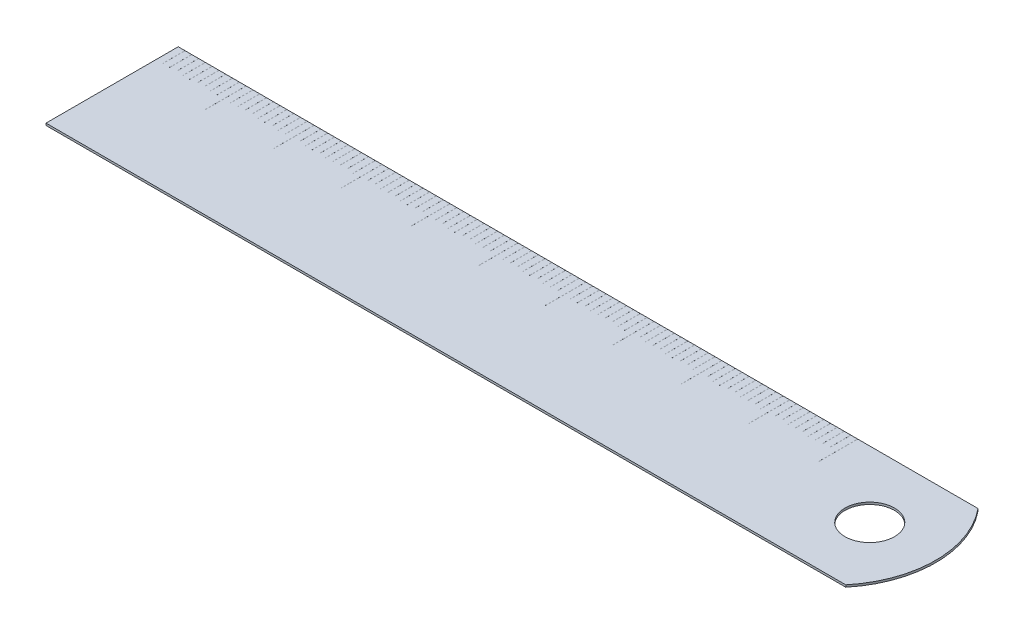
from build123d import *

# Parameters (mm, degrees)
SKETCH_1_R                        = 3.65
EXTRUDE_1_DEPTH                   = 0.31
SKETCH_2_W                        = 0.02
SKETCH_2_H                        = 12
CUT_EXTRUDE_1_DEPTH               = 0.002
PATTERN_LINEAR_1_COUNT            = 10
PATTERN_LINEAR_1_PITCH            = 10
SKETCH_3_W                        = 0.02
SKETCH_3_H                        = 6.6
CUT_EXTRUDE_3_DEPTH               = 0.002
PATTERN_LINEAR_2_COUNT            = 9
PATTERN_LINEAR_2_PITCH            = 1
PATTERN_LINEAR_3_COUNT            = 10
PATTERN_LINEAR_3_PITCH            = 10
PATTERN_LINEAR_3_COPY_1_SKETCH_W  = 0.02
PATTERN_LINEAR_3_COPY_1_SKETCH_H  = 6.6
PATTERN_LINEAR_3_COPY_1_DEPTH     = 0.002
PATTERN_LINEAR_3_COPY_2_SKETCH_W  = 0.02
PATTERN_LINEAR_3_COPY_2_SKETCH_H  = 6.6
PATTERN_LINEAR_3_COPY_2_DEPTH     = 0.002
PATTERN_LINEAR_3_COPY_3_SKETCH_W  = 0.02
PATTERN_LINEAR_3_COPY_3_SKETCH_H  = 6.6
PATTERN_LINEAR_3_COPY_3_DEPTH     = 0.002
PATTERN_LINEAR_3_COPY_4_SKETCH_W  = 0.02
PATTERN_LINEAR_3_COPY_4_SKETCH_H  = 6.6
PATTERN_LINEAR_3_COPY_4_DEPTH     = 0.002
PATTERN_LINEAR_3_COPY_5_SKETCH_W  = 0.02
PATTERN_LINEAR_3_COPY_5_SKETCH_H  = 6.6
PATTERN_LINEAR_3_COPY_5_DEPTH     = 0.002
PATTERN_LINEAR_3_COPY_6_SKETCH_W  = 0.02
PATTERN_LINEAR_3_COPY_6_SKETCH_H  = 6.6
PATTERN_LINEAR_3_COPY_6_DEPTH     = 0.002
PATTERN_LINEAR_3_COPY_7_SKETCH_W  = 0.02
PATTERN_LINEAR_3_COPY_7_SKETCH_H  = 6.6
PATTERN_LINEAR_3_COPY_7_DEPTH     = 0.002
PATTERN_LINEAR_3_COPY_8_SKETCH_W  = 0.02
PATTERN_LINEAR_3_COPY_8_SKETCH_H  = 6.6
PATTERN_LINEAR_3_COPY_8_DEPTH     = 0.002
PATTERN_LINEAR_3_COPY_9_SKETCH_W  = 0.02
PATTERN_LINEAR_3_COPY_9_SKETCH_H  = 6.6
PATTERN_LINEAR_3_COPY_9_DEPTH     = 0.002
PATTERN_LINEAR_3_COPY_10_SKETCH_W = 0.02
PATTERN_LINEAR_3_COPY_10_SKETCH_H = 6.6
PATTERN_LINEAR_3_COPY_10_DEPTH    = 0.002
PATTERN_LINEAR_3_COPY_11_SKETCH_W = 0.02
PATTERN_LINEAR_3_COPY_11_SKETCH_H = 6.6
PATTERN_LINEAR_3_COPY_11_DEPTH    = 0.002
PATTERN_LINEAR_3_COPY_12_SKETCH_W = 0.02
PATTERN_LINEAR_3_COPY_12_SKETCH_H = 6.6
PATTERN_LINEAR_3_COPY_12_DEPTH    = 0.002
PATTERN_LINEAR_3_COPY_13_SKETCH_W = 0.02
PATTERN_LINEAR_3_COPY_13_SKETCH_H = 6.6
PATTERN_LINEAR_3_COPY_13_DEPTH    = 0.002
PATTERN_LINEAR_3_COPY_14_SKETCH_W = 0.02
PATTERN_LINEAR_3_COPY_14_SKETCH_H = 6.6
PATTERN_LINEAR_3_COPY_14_DEPTH    = 0.002
PATTERN_LINEAR_3_COPY_15_SKETCH_W = 0.02
PATTERN_LINEAR_3_COPY_15_SKETCH_H = 6.6
PATTERN_LINEAR_3_COPY_15_DEPTH    = 0.002
PATTERN_LINEAR_3_COPY_16_SKETCH_W = 0.02
PATTERN_LINEAR_3_COPY_16_SKETCH_H = 6.6
PATTERN_LINEAR_3_COPY_16_DEPTH    = 0.002
PATTERN_LINEAR_3_COPY_17_SKETCH_W = 0.02
PATTERN_LINEAR_3_COPY_17_SKETCH_H = 6.6
PATTERN_LINEAR_3_COPY_17_DEPTH    = 0.002
PATTERN_LINEAR_3_COPY_18_SKETCH_W = 0.02
PATTERN_LINEAR_3_COPY_18_SKETCH_H = 6.6
PATTERN_LINEAR_3_COPY_18_DEPTH    = 0.002
PATTERN_LINEAR_3_COPY_19_SKETCH_W = 0.02
PATTERN_LINEAR_3_COPY_19_SKETCH_H = 6.6
PATTERN_LINEAR_3_COPY_19_DEPTH    = 0.002
PATTERN_LINEAR_3_COPY_20_SKETCH_W = 0.02
PATTERN_LINEAR_3_COPY_20_SKETCH_H = 6.6
PATTERN_LINEAR_3_COPY_20_DEPTH    = 0.002
PATTERN_LINEAR_3_COPY_21_SKETCH_W = 0.02
PATTERN_LINEAR_3_COPY_21_SKETCH_H = 6.6
PATTERN_LINEAR_3_COPY_21_DEPTH    = 0.002
PATTERN_LINEAR_3_COPY_22_SKETCH_W = 0.02
PATTERN_LINEAR_3_COPY_22_SKETCH_H = 6.6
PATTERN_LINEAR_3_COPY_22_DEPTH    = 0.002
PATTERN_LINEAR_3_COPY_23_SKETCH_W = 0.02
PATTERN_LINEAR_3_COPY_23_SKETCH_H = 6.6
PATTERN_LINEAR_3_COPY_23_DEPTH    = 0.002
PATTERN_LINEAR_3_COPY_24_SKETCH_W = 0.02
PATTERN_LINEAR_3_COPY_24_SKETCH_H = 6.6
PATTERN_LINEAR_3_COPY_24_DEPTH    = 0.002
PATTERN_LINEAR_3_COPY_25_SKETCH_W = 0.02
PATTERN_LINEAR_3_COPY_25_SKETCH_H = 6.6
PATTERN_LINEAR_3_COPY_25_DEPTH    = 0.002
PATTERN_LINEAR_3_COPY_26_SKETCH_W = 0.02
PATTERN_LINEAR_3_COPY_26_SKETCH_H = 6.6
PATTERN_LINEAR_3_COPY_26_DEPTH    = 0.002
PATTERN_LINEAR_3_COPY_27_SKETCH_W = 0.02
PATTERN_LINEAR_3_COPY_27_SKETCH_H = 6.6
PATTERN_LINEAR_3_COPY_27_DEPTH    = 0.002
PATTERN_LINEAR_3_COPY_28_SKETCH_W = 0.02
PATTERN_LINEAR_3_COPY_28_SKETCH_H = 6.6
PATTERN_LINEAR_3_COPY_28_DEPTH    = 0.002
PATTERN_LINEAR_3_COPY_29_SKETCH_W = 0.02
PATTERN_LINEAR_3_COPY_29_SKETCH_H = 6.6
PATTERN_LINEAR_3_COPY_29_DEPTH    = 0.002
PATTERN_LINEAR_3_COPY_30_SKETCH_W = 0.02
PATTERN_LINEAR_3_COPY_30_SKETCH_H = 6.6
PATTERN_LINEAR_3_COPY_30_DEPTH    = 0.002
PATTERN_LINEAR_3_COPY_31_SKETCH_W = 0.02
PATTERN_LINEAR_3_COPY_31_SKETCH_H = 6.6
PATTERN_LINEAR_3_COPY_31_DEPTH    = 0.002
PATTERN_LINEAR_3_COPY_32_SKETCH_W = 0.02
PATTERN_LINEAR_3_COPY_32_SKETCH_H = 6.6
PATTERN_LINEAR_3_COPY_32_DEPTH    = 0.002
PATTERN_LINEAR_3_COPY_33_SKETCH_W = 0.02
PATTERN_LINEAR_3_COPY_33_SKETCH_H = 6.6
PATTERN_LINEAR_3_COPY_33_DEPTH    = 0.002
PATTERN_LINEAR_3_COPY_34_SKETCH_W = 0.02
PATTERN_LINEAR_3_COPY_34_SKETCH_H = 6.6
PATTERN_LINEAR_3_COPY_34_DEPTH    = 0.002
PATTERN_LINEAR_3_COPY_35_SKETCH_W = 0.02
PATTERN_LINEAR_3_COPY_35_SKETCH_H = 6.6
PATTERN_LINEAR_3_COPY_35_DEPTH    = 0.002
PATTERN_LINEAR_3_COPY_36_SKETCH_W = 0.02
PATTERN_LINEAR_3_COPY_36_SKETCH_H = 6.6
PATTERN_LINEAR_3_COPY_36_DEPTH    = 0.002
PATTERN_LINEAR_3_COPY_37_SKETCH_W = 0.02
PATTERN_LINEAR_3_COPY_37_SKETCH_H = 6.6
PATTERN_LINEAR_3_COPY_37_DEPTH    = 0.002
PATTERN_LINEAR_3_COPY_38_SKETCH_W = 0.02
PATTERN_LINEAR_3_COPY_38_SKETCH_H = 6.6
PATTERN_LINEAR_3_COPY_38_DEPTH    = 0.002
PATTERN_LINEAR_3_COPY_39_SKETCH_W = 0.02
PATTERN_LINEAR_3_COPY_39_SKETCH_H = 6.6
PATTERN_LINEAR_3_COPY_39_DEPTH    = 0.002
PATTERN_LINEAR_3_COPY_40_SKETCH_W = 0.02
PATTERN_LINEAR_3_COPY_40_SKETCH_H = 6.6
PATTERN_LINEAR_3_COPY_40_DEPTH    = 0.002
PATTERN_LINEAR_3_COPY_41_SKETCH_W = 0.02
PATTERN_LINEAR_3_COPY_41_SKETCH_H = 6.6
PATTERN_LINEAR_3_COPY_41_DEPTH    = 0.002
PATTERN_LINEAR_3_COPY_42_SKETCH_W = 0.02
PATTERN_LINEAR_3_COPY_42_SKETCH_H = 6.6
PATTERN_LINEAR_3_COPY_42_DEPTH    = 0.002
PATTERN_LINEAR_3_COPY_43_SKETCH_W = 0.02
PATTERN_LINEAR_3_COPY_43_SKETCH_H = 6.6
PATTERN_LINEAR_3_COPY_43_DEPTH    = 0.002
PATTERN_LINEAR_3_COPY_44_SKETCH_W = 0.02
PATTERN_LINEAR_3_COPY_44_SKETCH_H = 6.6
PATTERN_LINEAR_3_COPY_44_DEPTH    = 0.002
PATTERN_LINEAR_3_COPY_45_SKETCH_W = 0.02
PATTERN_LINEAR_3_COPY_45_SKETCH_H = 6.6
PATTERN_LINEAR_3_COPY_45_DEPTH    = 0.002
PATTERN_LINEAR_3_COPY_46_SKETCH_W = 0.02
PATTERN_LINEAR_3_COPY_46_SKETCH_H = 6.6
PATTERN_LINEAR_3_COPY_46_DEPTH    = 0.002
PATTERN_LINEAR_3_COPY_47_SKETCH_W = 0.02
PATTERN_LINEAR_3_COPY_47_SKETCH_H = 6.6
PATTERN_LINEAR_3_COPY_47_DEPTH    = 0.002
PATTERN_LINEAR_3_COPY_48_SKETCH_W = 0.02
PATTERN_LINEAR_3_COPY_48_SKETCH_H = 6.6
PATTERN_LINEAR_3_COPY_48_DEPTH    = 0.002
PATTERN_LINEAR_3_COPY_49_SKETCH_W = 0.02
PATTERN_LINEAR_3_COPY_49_SKETCH_H = 6.6
PATTERN_LINEAR_3_COPY_49_DEPTH    = 0.002
PATTERN_LINEAR_3_COPY_50_SKETCH_W = 0.02
PATTERN_LINEAR_3_COPY_50_SKETCH_H = 6.6
PATTERN_LINEAR_3_COPY_50_DEPTH    = 0.002
PATTERN_LINEAR_3_COPY_51_SKETCH_W = 0.02
PATTERN_LINEAR_3_COPY_51_SKETCH_H = 6.6
PATTERN_LINEAR_3_COPY_51_DEPTH    = 0.002
PATTERN_LINEAR_3_COPY_52_SKETCH_W = 0.02
PATTERN_LINEAR_3_COPY_52_SKETCH_H = 6.6
PATTERN_LINEAR_3_COPY_52_DEPTH    = 0.002
PATTERN_LINEAR_3_COPY_53_SKETCH_W = 0.02
PATTERN_LINEAR_3_COPY_53_SKETCH_H = 6.6
PATTERN_LINEAR_3_COPY_53_DEPTH    = 0.002
PATTERN_LINEAR_3_COPY_54_SKETCH_W = 0.02
PATTERN_LINEAR_3_COPY_54_SKETCH_H = 6.6
PATTERN_LINEAR_3_COPY_54_DEPTH    = 0.002
PATTERN_LINEAR_3_COPY_55_SKETCH_W = 0.02
PATTERN_LINEAR_3_COPY_55_SKETCH_H = 6.6
PATTERN_LINEAR_3_COPY_55_DEPTH    = 0.002
PATTERN_LINEAR_3_COPY_56_SKETCH_W = 0.02
PATTERN_LINEAR_3_COPY_56_SKETCH_H = 6.6
PATTERN_LINEAR_3_COPY_56_DEPTH    = 0.002
PATTERN_LINEAR_3_COPY_57_SKETCH_W = 0.02
PATTERN_LINEAR_3_COPY_57_SKETCH_H = 6.6
PATTERN_LINEAR_3_COPY_57_DEPTH    = 0.002
PATTERN_LINEAR_3_COPY_58_SKETCH_W = 0.02
PATTERN_LINEAR_3_COPY_58_SKETCH_H = 6.6
PATTERN_LINEAR_3_COPY_58_DEPTH    = 0.002
PATTERN_LINEAR_3_COPY_59_SKETCH_W = 0.02
PATTERN_LINEAR_3_COPY_59_SKETCH_H = 6.6
PATTERN_LINEAR_3_COPY_59_DEPTH    = 0.002
PATTERN_LINEAR_3_COPY_60_SKETCH_W = 0.02
PATTERN_LINEAR_3_COPY_60_SKETCH_H = 6.6
PATTERN_LINEAR_3_COPY_60_DEPTH    = 0.002
PATTERN_LINEAR_3_COPY_61_SKETCH_W = 0.02
PATTERN_LINEAR_3_COPY_61_SKETCH_H = 6.6
PATTERN_LINEAR_3_COPY_61_DEPTH    = 0.002
PATTERN_LINEAR_3_COPY_62_SKETCH_W = 0.02
PATTERN_LINEAR_3_COPY_62_SKETCH_H = 6.6
PATTERN_LINEAR_3_COPY_62_DEPTH    = 0.002
PATTERN_LINEAR_3_COPY_63_SKETCH_W = 0.02
PATTERN_LINEAR_3_COPY_63_SKETCH_H = 6.6
PATTERN_LINEAR_3_COPY_63_DEPTH    = 0.002
PATTERN_LINEAR_3_COPY_64_SKETCH_W = 0.02
PATTERN_LINEAR_3_COPY_64_SKETCH_H = 6.6
PATTERN_LINEAR_3_COPY_64_DEPTH    = 0.002
PATTERN_LINEAR_3_COPY_65_SKETCH_W = 0.02
PATTERN_LINEAR_3_COPY_65_SKETCH_H = 6.6
PATTERN_LINEAR_3_COPY_65_DEPTH    = 0.002
PATTERN_LINEAR_3_COPY_66_SKETCH_W = 0.02
PATTERN_LINEAR_3_COPY_66_SKETCH_H = 6.6
PATTERN_LINEAR_3_COPY_66_DEPTH    = 0.002
PATTERN_LINEAR_3_COPY_67_SKETCH_W = 0.02
PATTERN_LINEAR_3_COPY_67_SKETCH_H = 6.6
PATTERN_LINEAR_3_COPY_67_DEPTH    = 0.002
PATTERN_LINEAR_3_COPY_68_SKETCH_W = 0.02
PATTERN_LINEAR_3_COPY_68_SKETCH_H = 6.6
PATTERN_LINEAR_3_COPY_68_DEPTH    = 0.002
PATTERN_LINEAR_3_COPY_69_SKETCH_W = 0.02
PATTERN_LINEAR_3_COPY_69_SKETCH_H = 6.6
PATTERN_LINEAR_3_COPY_69_DEPTH    = 0.002
PATTERN_LINEAR_3_COPY_70_SKETCH_W = 0.02
PATTERN_LINEAR_3_COPY_70_SKETCH_H = 6.6
PATTERN_LINEAR_3_COPY_70_DEPTH    = 0.002
PATTERN_LINEAR_3_COPY_71_SKETCH_W = 0.02
PATTERN_LINEAR_3_COPY_71_SKETCH_H = 6.6
PATTERN_LINEAR_3_COPY_71_DEPTH    = 0.002
PATTERN_LINEAR_3_COPY_72_SKETCH_W = 0.02
PATTERN_LINEAR_3_COPY_72_SKETCH_H = 6.6
PATTERN_LINEAR_3_COPY_72_DEPTH    = 0.002


with BuildPart() as part:
    # 草图1 → 凸台-拉伸1 (new body)
    with BuildSketch(Plane(origin=(0, 0, 0), x_dir=(1, 0, 0), z_dir=(0, 1, 0))):
        with BuildLine():
            Line((-60.6, -9.73), (57.1, -9.73))
            ThreePointArc((57.1, -9.73), (59.698390659, -5.170176496), (60.6, 0))
            ThreePointArc((60.6, 0), (59.698390659, 5.170176496), (57.1, 9.73))
            Line((57.1, 9.73), (-60.6, 9.73))
            Line((-60.6, 9.73), (-60.6, -9.73))
        make_face()
        with Locations(Location((50.9, 0, 0), (0, 0, 270))):
            Circle(SKETCH_1_R, mode=Mode.SUBTRACT)
    extrude(amount=EXTRUDE_1_DEPTH)

    # 草图2 → 切除-拉伸1 (cut)
    with BuildSketch(Plane(origin=(0, 0.31, 0), x_dir=(1, 0, 0), z_dir=(0, 1, 0))):
        with Locations((-50.6, 9.73)):
            Rectangle(SKETCH_2_W, SKETCH_2_H)
    cut_extrude_1 = extrude(amount=-CUT_EXTRUDE_1_DEPTH, mode=Mode.SUBTRACT)

    # 阵列(线性)1: 切除-拉伸1 ×10
    with Locations(*[(i * PATTERN_LINEAR_1_PITCH, 0, 0) for i in range(1, PATTERN_LINEAR_1_COUNT)]):
        add(cut_extrude_1, mode=Mode.SUBTRACT)

    # 草图3 → 切除-拉伸3 (cut)
    with BuildSketch(Plane(origin=(0, 0.31, 0), x_dir=(1, 0, 0), z_dir=(0, 1, 0))):
        with Locations((-59.6, 9.73)):
            Rectangle(SKETCH_3_W, SKETCH_3_H)
    cut_extrude_3 = extrude(amount=-CUT_EXTRUDE_3_DEPTH, mode=Mode.SUBTRACT)

    # 阵列(线性)2: 切除-拉伸3 ×9
    with Locations(*[(i * PATTERN_LINEAR_2_PITCH, 0, 0) for i in range(1, PATTERN_LINEAR_2_COUNT)]):
        add(cut_extrude_3, mode=Mode.SUBTRACT)

    # 阵列(线性)3: 切除-拉伸3 ×10
    with Locations(*[(i * PATTERN_LINEAR_3_PITCH, 0, 0) for i in range(1, PATTERN_LINEAR_3_COUNT)]):
        add(cut_extrude_3, mode=Mode.SUBTRACT)

    # 阵列(线性)3 copy 1 sketch → 阵列(线性)3 copy 1 (cut)
    with BuildSketch(Plane(origin=(11, 0.31, 0), x_dir=(1, 0, 0), z_dir=(0, 1, 0))):
        with Locations((-59.6, 9.73)):
            Rectangle(PATTERN_LINEAR_3_COPY_1_SKETCH_W, PATTERN_LINEAR_3_COPY_1_SKETCH_H)
    extrude(amount=-PATTERN_LINEAR_3_COPY_1_DEPTH, mode=Mode.SUBTRACT)

    # 阵列(线性)3 copy 2 sketch → 阵列(线性)3 copy 2 (cut)
    with BuildSketch(Plane(origin=(21, 0.31, 0), x_dir=(1, 0, 0), z_dir=(0, 1, 0))):
        with Locations((-59.6, 9.73)):
            Rectangle(PATTERN_LINEAR_3_COPY_2_SKETCH_W, PATTERN_LINEAR_3_COPY_2_SKETCH_H)
    extrude(amount=-PATTERN_LINEAR_3_COPY_2_DEPTH, mode=Mode.SUBTRACT)

    # 阵列(线性)3 copy 3 sketch → 阵列(线性)3 copy 3 (cut)
    with BuildSketch(Plane(origin=(31, 0.31, 0), x_dir=(1, 0, 0), z_dir=(0, 1, 0))):
        with Locations((-59.6, 9.73)):
            Rectangle(PATTERN_LINEAR_3_COPY_3_SKETCH_W, PATTERN_LINEAR_3_COPY_3_SKETCH_H)
    extrude(amount=-PATTERN_LINEAR_3_COPY_3_DEPTH, mode=Mode.SUBTRACT)

    # 阵列(线性)3 copy 4 sketch → 阵列(线性)3 copy 4 (cut)
    with BuildSketch(Plane(origin=(41, 0.31, 0), x_dir=(1, 0, 0), z_dir=(0, 1, 0))):
        with Locations((-59.6, 9.73)):
            Rectangle(PATTERN_LINEAR_3_COPY_4_SKETCH_W, PATTERN_LINEAR_3_COPY_4_SKETCH_H)
    extrude(amount=-PATTERN_LINEAR_3_COPY_4_DEPTH, mode=Mode.SUBTRACT)

    # 阵列(线性)3 copy 5 sketch → 阵列(线性)3 copy 5 (cut)
    with BuildSketch(Plane(origin=(51, 0.31, 0), x_dir=(1, 0, 0), z_dir=(0, 1, 0))):
        with Locations((-59.6, 9.73)):
            Rectangle(PATTERN_LINEAR_3_COPY_5_SKETCH_W, PATTERN_LINEAR_3_COPY_5_SKETCH_H)
    extrude(amount=-PATTERN_LINEAR_3_COPY_5_DEPTH, mode=Mode.SUBTRACT)

    # 阵列(线性)3 copy 6 sketch → 阵列(线性)3 copy 6 (cut)
    with BuildSketch(Plane(origin=(61, 0.31, 0), x_dir=(1, 0, 0), z_dir=(0, 1, 0))):
        with Locations((-59.6, 9.73)):
            Rectangle(PATTERN_LINEAR_3_COPY_6_SKETCH_W, PATTERN_LINEAR_3_COPY_6_SKETCH_H)
    extrude(amount=-PATTERN_LINEAR_3_COPY_6_DEPTH, mode=Mode.SUBTRACT)

    # 阵列(线性)3 copy 7 sketch → 阵列(线性)3 copy 7 (cut)
    with BuildSketch(Plane(origin=(71, 0.31, 0), x_dir=(1, 0, 0), z_dir=(0, 1, 0))):
        with Locations((-59.6, 9.73)):
            Rectangle(PATTERN_LINEAR_3_COPY_7_SKETCH_W, PATTERN_LINEAR_3_COPY_7_SKETCH_H)
    extrude(amount=-PATTERN_LINEAR_3_COPY_7_DEPTH, mode=Mode.SUBTRACT)

    # 阵列(线性)3 copy 8 sketch → 阵列(线性)3 copy 8 (cut)
    with BuildSketch(Plane(origin=(81, 0.31, 0), x_dir=(1, 0, 0), z_dir=(0, 1, 0))):
        with Locations((-59.6, 9.73)):
            Rectangle(PATTERN_LINEAR_3_COPY_8_SKETCH_W, PATTERN_LINEAR_3_COPY_8_SKETCH_H)
    extrude(amount=-PATTERN_LINEAR_3_COPY_8_DEPTH, mode=Mode.SUBTRACT)

    # 阵列(线性)3 copy 9 sketch → 阵列(线性)3 copy 9 (cut)
    with BuildSketch(Plane(origin=(91, 0.31, 0), x_dir=(1, 0, 0), z_dir=(0, 1, 0))):
        with Locations((-59.6, 9.73)):
            Rectangle(PATTERN_LINEAR_3_COPY_9_SKETCH_W, PATTERN_LINEAR_3_COPY_9_SKETCH_H)
    extrude(amount=-PATTERN_LINEAR_3_COPY_9_DEPTH, mode=Mode.SUBTRACT)

    # 阵列(线性)3 copy 10 sketch → 阵列(线性)3 copy 10 (cut)
    with BuildSketch(Plane(origin=(12, 0.31, 0), x_dir=(1, 0, 0), z_dir=(0, 1, 0))):
        with Locations((-59.6, 9.73)):
            Rectangle(PATTERN_LINEAR_3_COPY_10_SKETCH_W, PATTERN_LINEAR_3_COPY_10_SKETCH_H)
    extrude(amount=-PATTERN_LINEAR_3_COPY_10_DEPTH, mode=Mode.SUBTRACT)

    # 阵列(线性)3 copy 11 sketch → 阵列(线性)3 copy 11 (cut)
    with BuildSketch(Plane(origin=(22, 0.31, 0), x_dir=(1, 0, 0), z_dir=(0, 1, 0))):
        with Locations((-59.6, 9.73)):
            Rectangle(PATTERN_LINEAR_3_COPY_11_SKETCH_W, PATTERN_LINEAR_3_COPY_11_SKETCH_H)
    extrude(amount=-PATTERN_LINEAR_3_COPY_11_DEPTH, mode=Mode.SUBTRACT)

    # 阵列(线性)3 copy 12 sketch → 阵列(线性)3 copy 12 (cut)
    with BuildSketch(Plane(origin=(32, 0.31, 0), x_dir=(1, 0, 0), z_dir=(0, 1, 0))):
        with Locations((-59.6, 9.73)):
            Rectangle(PATTERN_LINEAR_3_COPY_12_SKETCH_W, PATTERN_LINEAR_3_COPY_12_SKETCH_H)
    extrude(amount=-PATTERN_LINEAR_3_COPY_12_DEPTH, mode=Mode.SUBTRACT)

    # 阵列(线性)3 copy 13 sketch → 阵列(线性)3 copy 13 (cut)
    with BuildSketch(Plane(origin=(42, 0.31, 0), x_dir=(1, 0, 0), z_dir=(0, 1, 0))):
        with Locations((-59.6, 9.73)):
            Rectangle(PATTERN_LINEAR_3_COPY_13_SKETCH_W, PATTERN_LINEAR_3_COPY_13_SKETCH_H)
    extrude(amount=-PATTERN_LINEAR_3_COPY_13_DEPTH, mode=Mode.SUBTRACT)

    # 阵列(线性)3 copy 14 sketch → 阵列(线性)3 copy 14 (cut)
    with BuildSketch(Plane(origin=(52, 0.31, 0), x_dir=(1, 0, 0), z_dir=(0, 1, 0))):
        with Locations((-59.6, 9.73)):
            Rectangle(PATTERN_LINEAR_3_COPY_14_SKETCH_W, PATTERN_LINEAR_3_COPY_14_SKETCH_H)
    extrude(amount=-PATTERN_LINEAR_3_COPY_14_DEPTH, mode=Mode.SUBTRACT)

    # 阵列(线性)3 copy 15 sketch → 阵列(线性)3 copy 15 (cut)
    with BuildSketch(Plane(origin=(62, 0.31, 0), x_dir=(1, 0, 0), z_dir=(0, 1, 0))):
        with Locations((-59.6, 9.73)):
            Rectangle(PATTERN_LINEAR_3_COPY_15_SKETCH_W, PATTERN_LINEAR_3_COPY_15_SKETCH_H)
    extrude(amount=-PATTERN_LINEAR_3_COPY_15_DEPTH, mode=Mode.SUBTRACT)

    # 阵列(线性)3 copy 16 sketch → 阵列(线性)3 copy 16 (cut)
    with BuildSketch(Plane(origin=(72, 0.31, 0), x_dir=(1, 0, 0), z_dir=(0, 1, 0))):
        with Locations((-59.6, 9.73)):
            Rectangle(PATTERN_LINEAR_3_COPY_16_SKETCH_W, PATTERN_LINEAR_3_COPY_16_SKETCH_H)
    extrude(amount=-PATTERN_LINEAR_3_COPY_16_DEPTH, mode=Mode.SUBTRACT)

    # 阵列(线性)3 copy 17 sketch → 阵列(线性)3 copy 17 (cut)
    with BuildSketch(Plane(origin=(82, 0.31, 0), x_dir=(1, 0, 0), z_dir=(0, 1, 0))):
        with Locations((-59.6, 9.73)):
            Rectangle(PATTERN_LINEAR_3_COPY_17_SKETCH_W, PATTERN_LINEAR_3_COPY_17_SKETCH_H)
    extrude(amount=-PATTERN_LINEAR_3_COPY_17_DEPTH, mode=Mode.SUBTRACT)

    # 阵列(线性)3 copy 18 sketch → 阵列(线性)3 copy 18 (cut)
    with BuildSketch(Plane(origin=(92, 0.31, 0), x_dir=(1, 0, 0), z_dir=(0, 1, 0))):
        with Locations((-59.6, 9.73)):
            Rectangle(PATTERN_LINEAR_3_COPY_18_SKETCH_W, PATTERN_LINEAR_3_COPY_18_SKETCH_H)
    extrude(amount=-PATTERN_LINEAR_3_COPY_18_DEPTH, mode=Mode.SUBTRACT)

    # 阵列(线性)3 copy 19 sketch → 阵列(线性)3 copy 19 (cut)
    with BuildSketch(Plane(origin=(13, 0.31, 0), x_dir=(1, 0, 0), z_dir=(0, 1, 0))):
        with Locations((-59.6, 9.73)):
            Rectangle(PATTERN_LINEAR_3_COPY_19_SKETCH_W, PATTERN_LINEAR_3_COPY_19_SKETCH_H)
    extrude(amount=-PATTERN_LINEAR_3_COPY_19_DEPTH, mode=Mode.SUBTRACT)

    # 阵列(线性)3 copy 20 sketch → 阵列(线性)3 copy 20 (cut)
    with BuildSketch(Plane(origin=(23, 0.31, 0), x_dir=(1, 0, 0), z_dir=(0, 1, 0))):
        with Locations((-59.6, 9.73)):
            Rectangle(PATTERN_LINEAR_3_COPY_20_SKETCH_W, PATTERN_LINEAR_3_COPY_20_SKETCH_H)
    extrude(amount=-PATTERN_LINEAR_3_COPY_20_DEPTH, mode=Mode.SUBTRACT)

    # 阵列(线性)3 copy 21 sketch → 阵列(线性)3 copy 21 (cut)
    with BuildSketch(Plane(origin=(33, 0.31, 0), x_dir=(1, 0, 0), z_dir=(0, 1, 0))):
        with Locations((-59.6, 9.73)):
            Rectangle(PATTERN_LINEAR_3_COPY_21_SKETCH_W, PATTERN_LINEAR_3_COPY_21_SKETCH_H)
    extrude(amount=-PATTERN_LINEAR_3_COPY_21_DEPTH, mode=Mode.SUBTRACT)

    # 阵列(线性)3 copy 22 sketch → 阵列(线性)3 copy 22 (cut)
    with BuildSketch(Plane(origin=(43, 0.31, 0), x_dir=(1, 0, 0), z_dir=(0, 1, 0))):
        with Locations((-59.6, 9.73)):
            Rectangle(PATTERN_LINEAR_3_COPY_22_SKETCH_W, PATTERN_LINEAR_3_COPY_22_SKETCH_H)
    extrude(amount=-PATTERN_LINEAR_3_COPY_22_DEPTH, mode=Mode.SUBTRACT)

    # 阵列(线性)3 copy 23 sketch → 阵列(线性)3 copy 23 (cut)
    with BuildSketch(Plane(origin=(53, 0.31, 0), x_dir=(1, 0, 0), z_dir=(0, 1, 0))):
        with Locations((-59.6, 9.73)):
            Rectangle(PATTERN_LINEAR_3_COPY_23_SKETCH_W, PATTERN_LINEAR_3_COPY_23_SKETCH_H)
    extrude(amount=-PATTERN_LINEAR_3_COPY_23_DEPTH, mode=Mode.SUBTRACT)

    # 阵列(线性)3 copy 24 sketch → 阵列(线性)3 copy 24 (cut)
    with BuildSketch(Plane(origin=(63, 0.31, 0), x_dir=(1, 0, 0), z_dir=(0, 1, 0))):
        with Locations((-59.6, 9.73)):
            Rectangle(PATTERN_LINEAR_3_COPY_24_SKETCH_W, PATTERN_LINEAR_3_COPY_24_SKETCH_H)
    extrude(amount=-PATTERN_LINEAR_3_COPY_24_DEPTH, mode=Mode.SUBTRACT)

    # 阵列(线性)3 copy 25 sketch → 阵列(线性)3 copy 25 (cut)
    with BuildSketch(Plane(origin=(73, 0.31, 0), x_dir=(1, 0, 0), z_dir=(0, 1, 0))):
        with Locations((-59.6, 9.73)):
            Rectangle(PATTERN_LINEAR_3_COPY_25_SKETCH_W, PATTERN_LINEAR_3_COPY_25_SKETCH_H)
    extrude(amount=-PATTERN_LINEAR_3_COPY_25_DEPTH, mode=Mode.SUBTRACT)

    # 阵列(线性)3 copy 26 sketch → 阵列(线性)3 copy 26 (cut)
    with BuildSketch(Plane(origin=(83, 0.31, 0), x_dir=(1, 0, 0), z_dir=(0, 1, 0))):
        with Locations((-59.6, 9.73)):
            Rectangle(PATTERN_LINEAR_3_COPY_26_SKETCH_W, PATTERN_LINEAR_3_COPY_26_SKETCH_H)
    extrude(amount=-PATTERN_LINEAR_3_COPY_26_DEPTH, mode=Mode.SUBTRACT)

    # 阵列(线性)3 copy 27 sketch → 阵列(线性)3 copy 27 (cut)
    with BuildSketch(Plane(origin=(93, 0.31, 0), x_dir=(1, 0, 0), z_dir=(0, 1, 0))):
        with Locations((-59.6, 9.73)):
            Rectangle(PATTERN_LINEAR_3_COPY_27_SKETCH_W, PATTERN_LINEAR_3_COPY_27_SKETCH_H)
    extrude(amount=-PATTERN_LINEAR_3_COPY_27_DEPTH, mode=Mode.SUBTRACT)

    # 阵列(线性)3 copy 28 sketch → 阵列(线性)3 copy 28 (cut)
    with BuildSketch(Plane(origin=(14, 0.31, 0), x_dir=(1, 0, 0), z_dir=(0, 1, 0))):
        with Locations((-59.6, 9.73)):
            Rectangle(PATTERN_LINEAR_3_COPY_28_SKETCH_W, PATTERN_LINEAR_3_COPY_28_SKETCH_H)
    extrude(amount=-PATTERN_LINEAR_3_COPY_28_DEPTH, mode=Mode.SUBTRACT)

    # 阵列(线性)3 copy 29 sketch → 阵列(线性)3 copy 29 (cut)
    with BuildSketch(Plane(origin=(24, 0.31, 0), x_dir=(1, 0, 0), z_dir=(0, 1, 0))):
        with Locations((-59.6, 9.73)):
            Rectangle(PATTERN_LINEAR_3_COPY_29_SKETCH_W, PATTERN_LINEAR_3_COPY_29_SKETCH_H)
    extrude(amount=-PATTERN_LINEAR_3_COPY_29_DEPTH, mode=Mode.SUBTRACT)

    # 阵列(线性)3 copy 30 sketch → 阵列(线性)3 copy 30 (cut)
    with BuildSketch(Plane(origin=(34, 0.31, 0), x_dir=(1, 0, 0), z_dir=(0, 1, 0))):
        with Locations((-59.6, 9.73)):
            Rectangle(PATTERN_LINEAR_3_COPY_30_SKETCH_W, PATTERN_LINEAR_3_COPY_30_SKETCH_H)
    extrude(amount=-PATTERN_LINEAR_3_COPY_30_DEPTH, mode=Mode.SUBTRACT)

    # 阵列(线性)3 copy 31 sketch → 阵列(线性)3 copy 31 (cut)
    with BuildSketch(Plane(origin=(44, 0.31, 0), x_dir=(1, 0, 0), z_dir=(0, 1, 0))):
        with Locations((-59.6, 9.73)):
            Rectangle(PATTERN_LINEAR_3_COPY_31_SKETCH_W, PATTERN_LINEAR_3_COPY_31_SKETCH_H)
    extrude(amount=-PATTERN_LINEAR_3_COPY_31_DEPTH, mode=Mode.SUBTRACT)

    # 阵列(线性)3 copy 32 sketch → 阵列(线性)3 copy 32 (cut)
    with BuildSketch(Plane(origin=(54, 0.31, 0), x_dir=(1, 0, 0), z_dir=(0, 1, 0))):
        with Locations((-59.6, 9.73)):
            Rectangle(PATTERN_LINEAR_3_COPY_32_SKETCH_W, PATTERN_LINEAR_3_COPY_32_SKETCH_H)
    extrude(amount=-PATTERN_LINEAR_3_COPY_32_DEPTH, mode=Mode.SUBTRACT)

    # 阵列(线性)3 copy 33 sketch → 阵列(线性)3 copy 33 (cut)
    with BuildSketch(Plane(origin=(64, 0.31, 0), x_dir=(1, 0, 0), z_dir=(0, 1, 0))):
        with Locations((-59.6, 9.73)):
            Rectangle(PATTERN_LINEAR_3_COPY_33_SKETCH_W, PATTERN_LINEAR_3_COPY_33_SKETCH_H)
    extrude(amount=-PATTERN_LINEAR_3_COPY_33_DEPTH, mode=Mode.SUBTRACT)

    # 阵列(线性)3 copy 34 sketch → 阵列(线性)3 copy 34 (cut)
    with BuildSketch(Plane(origin=(74, 0.31, 0), x_dir=(1, 0, 0), z_dir=(0, 1, 0))):
        with Locations((-59.6, 9.73)):
            Rectangle(PATTERN_LINEAR_3_COPY_34_SKETCH_W, PATTERN_LINEAR_3_COPY_34_SKETCH_H)
    extrude(amount=-PATTERN_LINEAR_3_COPY_34_DEPTH, mode=Mode.SUBTRACT)

    # 阵列(线性)3 copy 35 sketch → 阵列(线性)3 copy 35 (cut)
    with BuildSketch(Plane(origin=(84, 0.31, 0), x_dir=(1, 0, 0), z_dir=(0, 1, 0))):
        with Locations((-59.6, 9.73)):
            Rectangle(PATTERN_LINEAR_3_COPY_35_SKETCH_W, PATTERN_LINEAR_3_COPY_35_SKETCH_H)
    extrude(amount=-PATTERN_LINEAR_3_COPY_35_DEPTH, mode=Mode.SUBTRACT)

    # 阵列(线性)3 copy 36 sketch → 阵列(线性)3 copy 36 (cut)
    with BuildSketch(Plane(origin=(94, 0.31, 0), x_dir=(1, 0, 0), z_dir=(0, 1, 0))):
        with Locations((-59.6, 9.73)):
            Rectangle(PATTERN_LINEAR_3_COPY_36_SKETCH_W, PATTERN_LINEAR_3_COPY_36_SKETCH_H)
    extrude(amount=-PATTERN_LINEAR_3_COPY_36_DEPTH, mode=Mode.SUBTRACT)

    # 阵列(线性)3 copy 37 sketch → 阵列(线性)3 copy 37 (cut)
    with BuildSketch(Plane(origin=(15, 0.31, 0), x_dir=(1, 0, 0), z_dir=(0, 1, 0))):
        with Locations((-59.6, 9.73)):
            Rectangle(PATTERN_LINEAR_3_COPY_37_SKETCH_W, PATTERN_LINEAR_3_COPY_37_SKETCH_H)
    extrude(amount=-PATTERN_LINEAR_3_COPY_37_DEPTH, mode=Mode.SUBTRACT)

    # 阵列(线性)3 copy 38 sketch → 阵列(线性)3 copy 38 (cut)
    with BuildSketch(Plane(origin=(25, 0.31, 0), x_dir=(1, 0, 0), z_dir=(0, 1, 0))):
        with Locations((-59.6, 9.73)):
            Rectangle(PATTERN_LINEAR_3_COPY_38_SKETCH_W, PATTERN_LINEAR_3_COPY_38_SKETCH_H)
    extrude(amount=-PATTERN_LINEAR_3_COPY_38_DEPTH, mode=Mode.SUBTRACT)

    # 阵列(线性)3 copy 39 sketch → 阵列(线性)3 copy 39 (cut)
    with BuildSketch(Plane(origin=(35, 0.31, 0), x_dir=(1, 0, 0), z_dir=(0, 1, 0))):
        with Locations((-59.6, 9.73)):
            Rectangle(PATTERN_LINEAR_3_COPY_39_SKETCH_W, PATTERN_LINEAR_3_COPY_39_SKETCH_H)
    extrude(amount=-PATTERN_LINEAR_3_COPY_39_DEPTH, mode=Mode.SUBTRACT)

    # 阵列(线性)3 copy 40 sketch → 阵列(线性)3 copy 40 (cut)
    with BuildSketch(Plane(origin=(45, 0.31, 0), x_dir=(1, 0, 0), z_dir=(0, 1, 0))):
        with Locations((-59.6, 9.73)):
            Rectangle(PATTERN_LINEAR_3_COPY_40_SKETCH_W, PATTERN_LINEAR_3_COPY_40_SKETCH_H)
    extrude(amount=-PATTERN_LINEAR_3_COPY_40_DEPTH, mode=Mode.SUBTRACT)

    # 阵列(线性)3 copy 41 sketch → 阵列(线性)3 copy 41 (cut)
    with BuildSketch(Plane(origin=(55, 0.31, 0), x_dir=(1, 0, 0), z_dir=(0, 1, 0))):
        with Locations((-59.6, 9.73)):
            Rectangle(PATTERN_LINEAR_3_COPY_41_SKETCH_W, PATTERN_LINEAR_3_COPY_41_SKETCH_H)
    extrude(amount=-PATTERN_LINEAR_3_COPY_41_DEPTH, mode=Mode.SUBTRACT)

    # 阵列(线性)3 copy 42 sketch → 阵列(线性)3 copy 42 (cut)
    with BuildSketch(Plane(origin=(65, 0.31, 0), x_dir=(1, 0, 0), z_dir=(0, 1, 0))):
        with Locations((-59.6, 9.73)):
            Rectangle(PATTERN_LINEAR_3_COPY_42_SKETCH_W, PATTERN_LINEAR_3_COPY_42_SKETCH_H)
    extrude(amount=-PATTERN_LINEAR_3_COPY_42_DEPTH, mode=Mode.SUBTRACT)

    # 阵列(线性)3 copy 43 sketch → 阵列(线性)3 copy 43 (cut)
    with BuildSketch(Plane(origin=(75, 0.31, 0), x_dir=(1, 0, 0), z_dir=(0, 1, 0))):
        with Locations((-59.6, 9.73)):
            Rectangle(PATTERN_LINEAR_3_COPY_43_SKETCH_W, PATTERN_LINEAR_3_COPY_43_SKETCH_H)
    extrude(amount=-PATTERN_LINEAR_3_COPY_43_DEPTH, mode=Mode.SUBTRACT)

    # 阵列(线性)3 copy 44 sketch → 阵列(线性)3 copy 44 (cut)
    with BuildSketch(Plane(origin=(85, 0.31, 0), x_dir=(1, 0, 0), z_dir=(0, 1, 0))):
        with Locations((-59.6, 9.73)):
            Rectangle(PATTERN_LINEAR_3_COPY_44_SKETCH_W, PATTERN_LINEAR_3_COPY_44_SKETCH_H)
    extrude(amount=-PATTERN_LINEAR_3_COPY_44_DEPTH, mode=Mode.SUBTRACT)

    # 阵列(线性)3 copy 45 sketch → 阵列(线性)3 copy 45 (cut)
    with BuildSketch(Plane(origin=(95, 0.31, 0), x_dir=(1, 0, 0), z_dir=(0, 1, 0))):
        with Locations((-59.6, 9.73)):
            Rectangle(PATTERN_LINEAR_3_COPY_45_SKETCH_W, PATTERN_LINEAR_3_COPY_45_SKETCH_H)
    extrude(amount=-PATTERN_LINEAR_3_COPY_45_DEPTH, mode=Mode.SUBTRACT)

    # 阵列(线性)3 copy 46 sketch → 阵列(线性)3 copy 46 (cut)
    with BuildSketch(Plane(origin=(16, 0.31, 0), x_dir=(1, 0, 0), z_dir=(0, 1, 0))):
        with Locations((-59.6, 9.73)):
            Rectangle(PATTERN_LINEAR_3_COPY_46_SKETCH_W, PATTERN_LINEAR_3_COPY_46_SKETCH_H)
    extrude(amount=-PATTERN_LINEAR_3_COPY_46_DEPTH, mode=Mode.SUBTRACT)

    # 阵列(线性)3 copy 47 sketch → 阵列(线性)3 copy 47 (cut)
    with BuildSketch(Plane(origin=(26, 0.31, 0), x_dir=(1, 0, 0), z_dir=(0, 1, 0))):
        with Locations((-59.6, 9.73)):
            Rectangle(PATTERN_LINEAR_3_COPY_47_SKETCH_W, PATTERN_LINEAR_3_COPY_47_SKETCH_H)
    extrude(amount=-PATTERN_LINEAR_3_COPY_47_DEPTH, mode=Mode.SUBTRACT)

    # 阵列(线性)3 copy 48 sketch → 阵列(线性)3 copy 48 (cut)
    with BuildSketch(Plane(origin=(36, 0.31, 0), x_dir=(1, 0, 0), z_dir=(0, 1, 0))):
        with Locations((-59.6, 9.73)):
            Rectangle(PATTERN_LINEAR_3_COPY_48_SKETCH_W, PATTERN_LINEAR_3_COPY_48_SKETCH_H)
    extrude(amount=-PATTERN_LINEAR_3_COPY_48_DEPTH, mode=Mode.SUBTRACT)

    # 阵列(线性)3 copy 49 sketch → 阵列(线性)3 copy 49 (cut)
    with BuildSketch(Plane(origin=(46, 0.31, 0), x_dir=(1, 0, 0), z_dir=(0, 1, 0))):
        with Locations((-59.6, 9.73)):
            Rectangle(PATTERN_LINEAR_3_COPY_49_SKETCH_W, PATTERN_LINEAR_3_COPY_49_SKETCH_H)
    extrude(amount=-PATTERN_LINEAR_3_COPY_49_DEPTH, mode=Mode.SUBTRACT)

    # 阵列(线性)3 copy 50 sketch → 阵列(线性)3 copy 50 (cut)
    with BuildSketch(Plane(origin=(56, 0.31, 0), x_dir=(1, 0, 0), z_dir=(0, 1, 0))):
        with Locations((-59.6, 9.73)):
            Rectangle(PATTERN_LINEAR_3_COPY_50_SKETCH_W, PATTERN_LINEAR_3_COPY_50_SKETCH_H)
    extrude(amount=-PATTERN_LINEAR_3_COPY_50_DEPTH, mode=Mode.SUBTRACT)

    # 阵列(线性)3 copy 51 sketch → 阵列(线性)3 copy 51 (cut)
    with BuildSketch(Plane(origin=(66, 0.31, 0), x_dir=(1, 0, 0), z_dir=(0, 1, 0))):
        with Locations((-59.6, 9.73)):
            Rectangle(PATTERN_LINEAR_3_COPY_51_SKETCH_W, PATTERN_LINEAR_3_COPY_51_SKETCH_H)
    extrude(amount=-PATTERN_LINEAR_3_COPY_51_DEPTH, mode=Mode.SUBTRACT)

    # 阵列(线性)3 copy 52 sketch → 阵列(线性)3 copy 52 (cut)
    with BuildSketch(Plane(origin=(76, 0.31, 0), x_dir=(1, 0, 0), z_dir=(0, 1, 0))):
        with Locations((-59.6, 9.73)):
            Rectangle(PATTERN_LINEAR_3_COPY_52_SKETCH_W, PATTERN_LINEAR_3_COPY_52_SKETCH_H)
    extrude(amount=-PATTERN_LINEAR_3_COPY_52_DEPTH, mode=Mode.SUBTRACT)

    # 阵列(线性)3 copy 53 sketch → 阵列(线性)3 copy 53 (cut)
    with BuildSketch(Plane(origin=(86, 0.31, 0), x_dir=(1, 0, 0), z_dir=(0, 1, 0))):
        with Locations((-59.6, 9.73)):
            Rectangle(PATTERN_LINEAR_3_COPY_53_SKETCH_W, PATTERN_LINEAR_3_COPY_53_SKETCH_H)
    extrude(amount=-PATTERN_LINEAR_3_COPY_53_DEPTH, mode=Mode.SUBTRACT)

    # 阵列(线性)3 copy 54 sketch → 阵列(线性)3 copy 54 (cut)
    with BuildSketch(Plane(origin=(96, 0.31, 0), x_dir=(1, 0, 0), z_dir=(0, 1, 0))):
        with Locations((-59.6, 9.73)):
            Rectangle(PATTERN_LINEAR_3_COPY_54_SKETCH_W, PATTERN_LINEAR_3_COPY_54_SKETCH_H)
    extrude(amount=-PATTERN_LINEAR_3_COPY_54_DEPTH, mode=Mode.SUBTRACT)

    # 阵列(线性)3 copy 55 sketch → 阵列(线性)3 copy 55 (cut)
    with BuildSketch(Plane(origin=(17, 0.31, 0), x_dir=(1, 0, 0), z_dir=(0, 1, 0))):
        with Locations((-59.6, 9.73)):
            Rectangle(PATTERN_LINEAR_3_COPY_55_SKETCH_W, PATTERN_LINEAR_3_COPY_55_SKETCH_H)
    extrude(amount=-PATTERN_LINEAR_3_COPY_55_DEPTH, mode=Mode.SUBTRACT)

    # 阵列(线性)3 copy 56 sketch → 阵列(线性)3 copy 56 (cut)
    with BuildSketch(Plane(origin=(27, 0.31, 0), x_dir=(1, 0, 0), z_dir=(0, 1, 0))):
        with Locations((-59.6, 9.73)):
            Rectangle(PATTERN_LINEAR_3_COPY_56_SKETCH_W, PATTERN_LINEAR_3_COPY_56_SKETCH_H)
    extrude(amount=-PATTERN_LINEAR_3_COPY_56_DEPTH, mode=Mode.SUBTRACT)

    # 阵列(线性)3 copy 57 sketch → 阵列(线性)3 copy 57 (cut)
    with BuildSketch(Plane(origin=(37, 0.31, 0), x_dir=(1, 0, 0), z_dir=(0, 1, 0))):
        with Locations((-59.6, 9.73)):
            Rectangle(PATTERN_LINEAR_3_COPY_57_SKETCH_W, PATTERN_LINEAR_3_COPY_57_SKETCH_H)
    extrude(amount=-PATTERN_LINEAR_3_COPY_57_DEPTH, mode=Mode.SUBTRACT)

    # 阵列(线性)3 copy 58 sketch → 阵列(线性)3 copy 58 (cut)
    with BuildSketch(Plane(origin=(47, 0.31, 0), x_dir=(1, 0, 0), z_dir=(0, 1, 0))):
        with Locations((-59.6, 9.73)):
            Rectangle(PATTERN_LINEAR_3_COPY_58_SKETCH_W, PATTERN_LINEAR_3_COPY_58_SKETCH_H)
    extrude(amount=-PATTERN_LINEAR_3_COPY_58_DEPTH, mode=Mode.SUBTRACT)

    # 阵列(线性)3 copy 59 sketch → 阵列(线性)3 copy 59 (cut)
    with BuildSketch(Plane(origin=(57, 0.31, 0), x_dir=(1, 0, 0), z_dir=(0, 1, 0))):
        with Locations((-59.6, 9.73)):
            Rectangle(PATTERN_LINEAR_3_COPY_59_SKETCH_W, PATTERN_LINEAR_3_COPY_59_SKETCH_H)
    extrude(amount=-PATTERN_LINEAR_3_COPY_59_DEPTH, mode=Mode.SUBTRACT)

    # 阵列(线性)3 copy 60 sketch → 阵列(线性)3 copy 60 (cut)
    with BuildSketch(Plane(origin=(67, 0.31, 0), x_dir=(1, 0, 0), z_dir=(0, 1, 0))):
        with Locations((-59.6, 9.73)):
            Rectangle(PATTERN_LINEAR_3_COPY_60_SKETCH_W, PATTERN_LINEAR_3_COPY_60_SKETCH_H)
    extrude(amount=-PATTERN_LINEAR_3_COPY_60_DEPTH, mode=Mode.SUBTRACT)

    # 阵列(线性)3 copy 61 sketch → 阵列(线性)3 copy 61 (cut)
    with BuildSketch(Plane(origin=(77, 0.31, 0), x_dir=(1, 0, 0), z_dir=(0, 1, 0))):
        with Locations((-59.6, 9.73)):
            Rectangle(PATTERN_LINEAR_3_COPY_61_SKETCH_W, PATTERN_LINEAR_3_COPY_61_SKETCH_H)
    extrude(amount=-PATTERN_LINEAR_3_COPY_61_DEPTH, mode=Mode.SUBTRACT)

    # 阵列(线性)3 copy 62 sketch → 阵列(线性)3 copy 62 (cut)
    with BuildSketch(Plane(origin=(87, 0.31, 0), x_dir=(1, 0, 0), z_dir=(0, 1, 0))):
        with Locations((-59.6, 9.73)):
            Rectangle(PATTERN_LINEAR_3_COPY_62_SKETCH_W, PATTERN_LINEAR_3_COPY_62_SKETCH_H)
    extrude(amount=-PATTERN_LINEAR_3_COPY_62_DEPTH, mode=Mode.SUBTRACT)

    # 阵列(线性)3 copy 63 sketch → 阵列(线性)3 copy 63 (cut)
    with BuildSketch(Plane(origin=(97, 0.31, 0), x_dir=(1, 0, 0), z_dir=(0, 1, 0))):
        with Locations((-59.6, 9.73)):
            Rectangle(PATTERN_LINEAR_3_COPY_63_SKETCH_W, PATTERN_LINEAR_3_COPY_63_SKETCH_H)
    extrude(amount=-PATTERN_LINEAR_3_COPY_63_DEPTH, mode=Mode.SUBTRACT)

    # 阵列(线性)3 copy 64 sketch → 阵列(线性)3 copy 64 (cut)
    with BuildSketch(Plane(origin=(18, 0.31, 0), x_dir=(1, 0, 0), z_dir=(0, 1, 0))):
        with Locations((-59.6, 9.73)):
            Rectangle(PATTERN_LINEAR_3_COPY_64_SKETCH_W, PATTERN_LINEAR_3_COPY_64_SKETCH_H)
    extrude(amount=-PATTERN_LINEAR_3_COPY_64_DEPTH, mode=Mode.SUBTRACT)

    # 阵列(线性)3 copy 65 sketch → 阵列(线性)3 copy 65 (cut)
    with BuildSketch(Plane(origin=(28, 0.31, 0), x_dir=(1, 0, 0), z_dir=(0, 1, 0))):
        with Locations((-59.6, 9.73)):
            Rectangle(PATTERN_LINEAR_3_COPY_65_SKETCH_W, PATTERN_LINEAR_3_COPY_65_SKETCH_H)
    extrude(amount=-PATTERN_LINEAR_3_COPY_65_DEPTH, mode=Mode.SUBTRACT)

    # 阵列(线性)3 copy 66 sketch → 阵列(线性)3 copy 66 (cut)
    with BuildSketch(Plane(origin=(38, 0.31, 0), x_dir=(1, 0, 0), z_dir=(0, 1, 0))):
        with Locations((-59.6, 9.73)):
            Rectangle(PATTERN_LINEAR_3_COPY_66_SKETCH_W, PATTERN_LINEAR_3_COPY_66_SKETCH_H)
    extrude(amount=-PATTERN_LINEAR_3_COPY_66_DEPTH, mode=Mode.SUBTRACT)

    # 阵列(线性)3 copy 67 sketch → 阵列(线性)3 copy 67 (cut)
    with BuildSketch(Plane(origin=(48, 0.31, 0), x_dir=(1, 0, 0), z_dir=(0, 1, 0))):
        with Locations((-59.6, 9.73)):
            Rectangle(PATTERN_LINEAR_3_COPY_67_SKETCH_W, PATTERN_LINEAR_3_COPY_67_SKETCH_H)
    extrude(amount=-PATTERN_LINEAR_3_COPY_67_DEPTH, mode=Mode.SUBTRACT)

    # 阵列(线性)3 copy 68 sketch → 阵列(线性)3 copy 68 (cut)
    with BuildSketch(Plane(origin=(58, 0.31, 0), x_dir=(1, 0, 0), z_dir=(0, 1, 0))):
        with Locations((-59.6, 9.73)):
            Rectangle(PATTERN_LINEAR_3_COPY_68_SKETCH_W, PATTERN_LINEAR_3_COPY_68_SKETCH_H)
    extrude(amount=-PATTERN_LINEAR_3_COPY_68_DEPTH, mode=Mode.SUBTRACT)

    # 阵列(线性)3 copy 69 sketch → 阵列(线性)3 copy 69 (cut)
    with BuildSketch(Plane(origin=(68, 0.31, 0), x_dir=(1, 0, 0), z_dir=(0, 1, 0))):
        with Locations((-59.6, 9.73)):
            Rectangle(PATTERN_LINEAR_3_COPY_69_SKETCH_W, PATTERN_LINEAR_3_COPY_69_SKETCH_H)
    extrude(amount=-PATTERN_LINEAR_3_COPY_69_DEPTH, mode=Mode.SUBTRACT)

    # 阵列(线性)3 copy 70 sketch → 阵列(线性)3 copy 70 (cut)
    with BuildSketch(Plane(origin=(78, 0.31, 0), x_dir=(1, 0, 0), z_dir=(0, 1, 0))):
        with Locations((-59.6, 9.73)):
            Rectangle(PATTERN_LINEAR_3_COPY_70_SKETCH_W, PATTERN_LINEAR_3_COPY_70_SKETCH_H)
    extrude(amount=-PATTERN_LINEAR_3_COPY_70_DEPTH, mode=Mode.SUBTRACT)

    # 阵列(线性)3 copy 71 sketch → 阵列(线性)3 copy 71 (cut)
    with BuildSketch(Plane(origin=(88, 0.31, 0), x_dir=(1, 0, 0), z_dir=(0, 1, 0))):
        with Locations((-59.6, 9.73)):
            Rectangle(PATTERN_LINEAR_3_COPY_71_SKETCH_W, PATTERN_LINEAR_3_COPY_71_SKETCH_H)
    extrude(amount=-PATTERN_LINEAR_3_COPY_71_DEPTH, mode=Mode.SUBTRACT)

    # 阵列(线性)3 copy 72 sketch → 阵列(线性)3 copy 72 (cut)
    with BuildSketch(Plane(origin=(98, 0.31, 0), x_dir=(1, 0, 0), z_dir=(0, 1, 0))):
        with Locations((-59.6, 9.73)):
            Rectangle(PATTERN_LINEAR_3_COPY_72_SKETCH_W, PATTERN_LINEAR_3_COPY_72_SKETCH_H)
    extrude(amount=-PATTERN_LINEAR_3_COPY_72_DEPTH, mode=Mode.SUBTRACT)


solid = part.part
